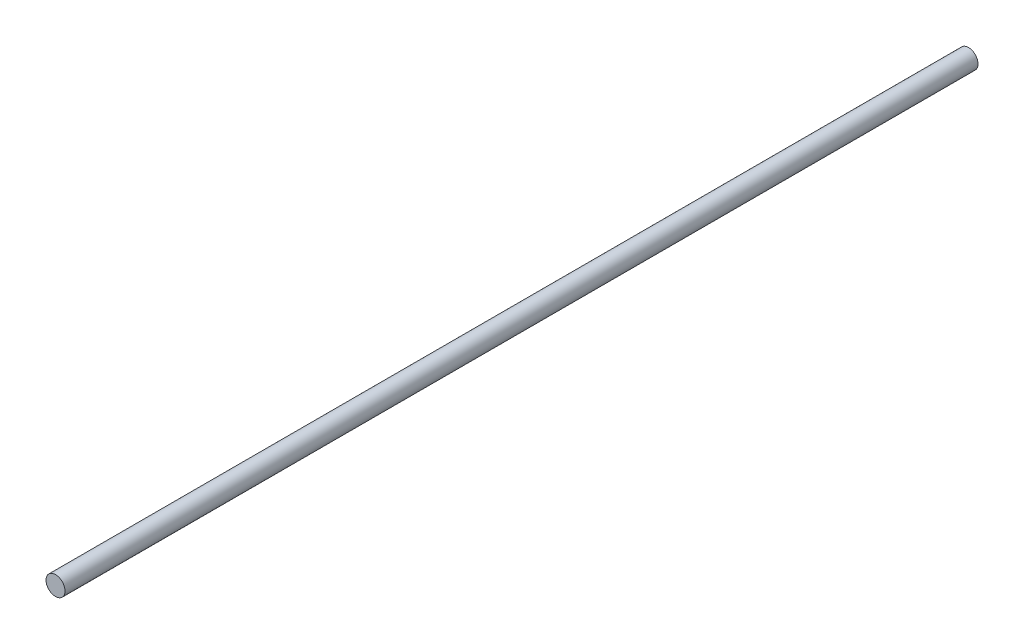
from build123d import *

# Parameters (mm, degrees)
SKETCH1_R           = 1.5875
BOSS_EXTRUDE1_DEPTH = 152.4


with BuildPart() as part:
    # Sketch1 → Boss-Extrude1 (new body)
    with BuildSketch(Plane.XY):
        with Locations(Location((0, 0, 0), (0, 0, 180))):
            Circle(SKETCH1_R)
    extrude(amount=BOSS_EXTRUDE1_DEPTH)


solid = part.part
